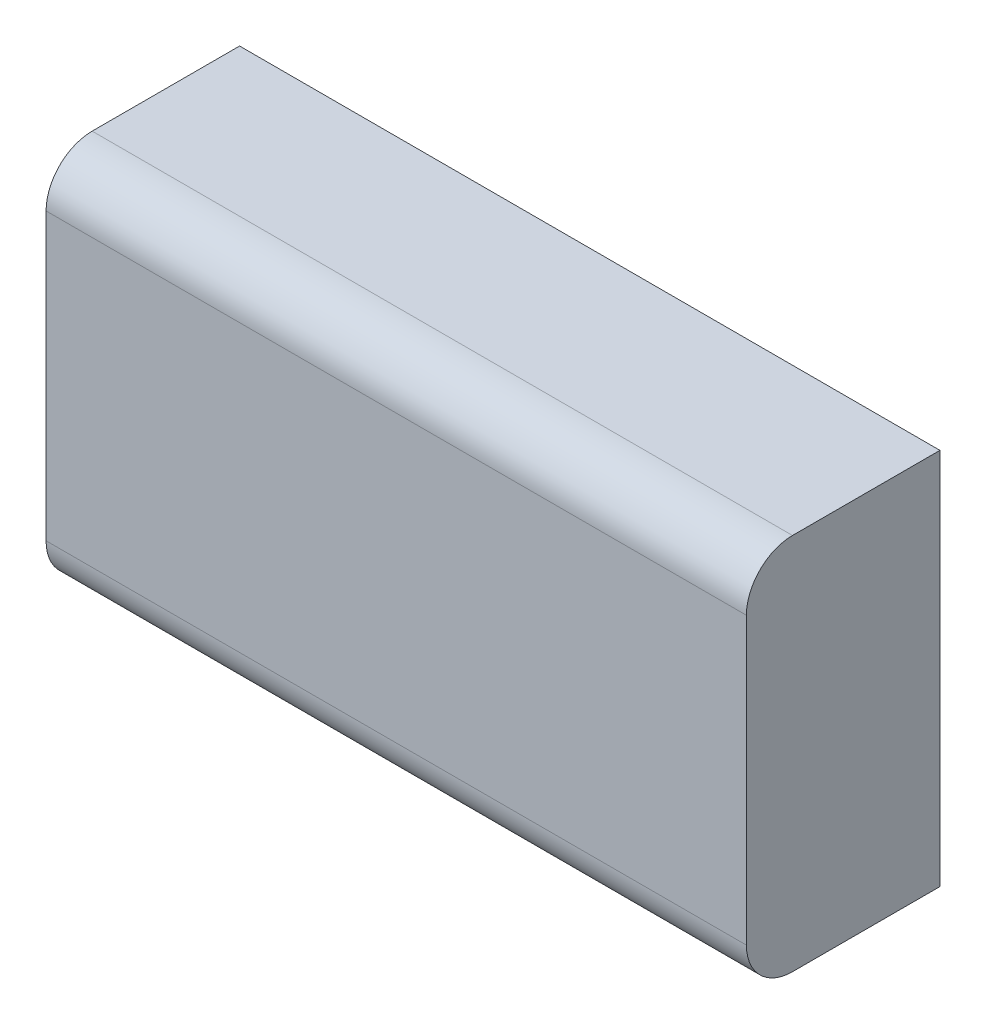
from build123d import *

# Parameters (mm, degrees)
SKETCH_1_W      = 76
SKETCH_1_H      = 41
EXTRUDE_1_DEPTH = 21
FILLET_1_R      = 5


with BuildPart() as part:
    # 草图1 → 凸台-拉伸1 (new body)
    with BuildSketch(Plane.XY):
        Rectangle(SKETCH_1_W, SKETCH_1_H)
    extrude(amount=EXTRUDE_1_DEPTH)

    # 圆角1
    fillet_1_edges = [part.edges().sort_by_distance(p)[0] for p in [
        (0, -20.5, 21),
        (0, 20.5, 21),
    ]]
    fillet(fillet_1_edges, radius=FILLET_1_R)


solid = part.part
